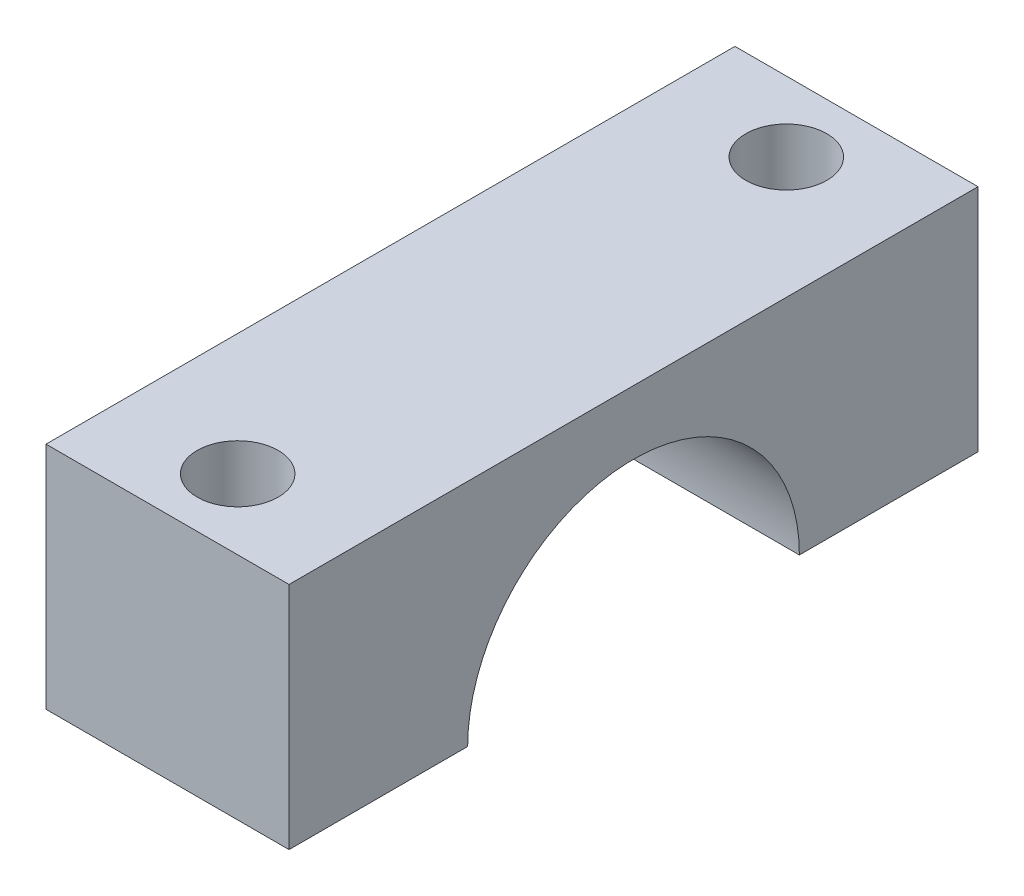
from build123d import *

# Parameters (mm, degrees)
BOSS_EXTRUDE1_DEPTH = 9.525
SKETCH2_R           = 1.5875
CUT_EXTRUDE1_DEPTH  = 19.814239953


with BuildPart() as part:
    # Sketch1 → Boss-Extrude1 (new body)
    with BuildSketch(Plane(origin=(0, 0, 0), x_dir=(0, 0, -1), z_dir=(1, 0, 0))):
        with BuildLine():
            Line((-6.5, 0), (-13.5, 0))
            Line((-13.5, 0), (-13.5, 9))
            Line((-13.5, 9), (13.5, 9))
            Line((13.5, 9), (13.5, 0))
            Line((13.5, 0), (6.5, 0))
            ThreePointArc((6.5, 0), (0, 6.5), (-6.5, 0))
        make_face()
    extrude(amount=BOSS_EXTRUDE1_DEPTH)

    # Sketch2 → Cut-Extrude1 (cut, through all)
    with BuildSketch(Plane(origin=(0, 9, 0), x_dir=(1, 0, 0), z_dir=(0, 1, 0))):
        with Locations(Location((4.7625, -10.75, 0), (0, 0, 270))):
            Circle(SKETCH2_R)
        with Locations(Location((4.7625, 10.75, 0), (0, 0, 270))):
            Circle(SKETCH2_R)
    extrude(amount=-CUT_EXTRUDE1_DEPTH, mode=Mode.SUBTRACT)


solid = part.part
